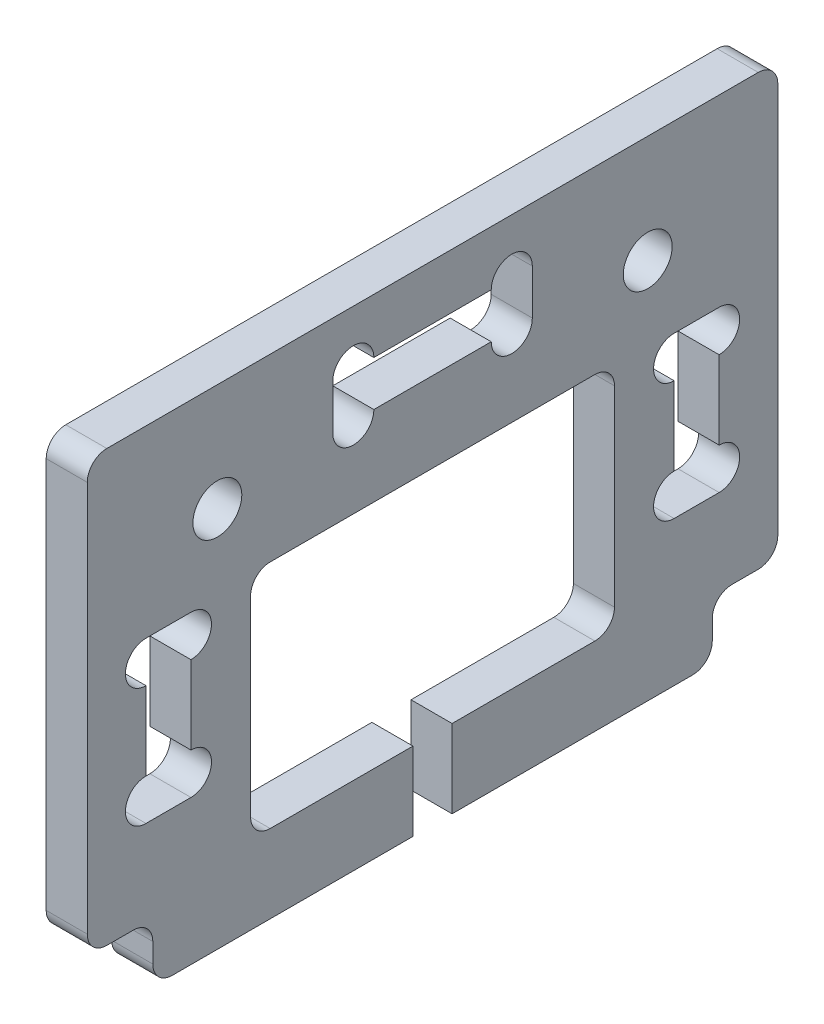
from build123d import *

# Parameters (mm, degrees)
SKETCH_1_W          = 18.6
SKETCH_1_H          = 11.8
SKETCH_1_R          = 1.25
EXTRUDE_1_DEPTH     = 2.1
FILLET_1_R          = 1
SKETCH_2_W          = 2
SKETCH_2_H          = 4
CUT_EXTRUDE_1_DEPTH = 10


with BuildPart() as part:
    # 草图1 → 凸台-拉伸1 (new body)
    with BuildSketch(Plane(origin=(0, 0, 0), x_dir=(0, 0, -1), z_dir=(1, 0, 0))):
        Polygon((14.3, -11), (17.65, -11), (17.65, 11), (-17.65, 11), (-17.65, -11), (-14.3, -11), (-14.3, -14), (14.3, -14), align=None)
        with BuildLine():
            ThreePointArc((-11.3, -5.55), (-11.60753788, -6.29246212), (-12.35, -6.6))
            Line((-12.35, -6.6), (-14.65, -6.6))
            ThreePointArc((-14.65, -6.6), (-15.7, -5.55), (-14.65, -4.5))
            Line((-14.65, -4.5), (-14.65, -0.5))
            ThreePointArc((-14.65, -0.5), (-15.7, 0.55), (-14.65, 1.6))
            Line((-14.65, 1.6), (-12.35, 1.6))
            ThreePointArc((-12.35, 1.6), (-11.60753788, 1.29246212), (-11.3, 0.55))
            ThreePointArc((-11.3, 0.55), (-11.60753788, -0.19246212), (-12.35, -0.5))
            Line((-12.35, -0.5), (-12.35, -4.5))
            ThreePointArc((-12.35, -4.5), (-11.60753788, -4.80753788), (-11.3, -5.55))
        make_face(mode=Mode.SUBTRACT)
        with Locations((0, -4.1)):
            Rectangle(SKETCH_1_W, SKETCH_1_H, mode=Mode.SUBTRACT)
        with BuildLine():
            ThreePointArc((15.7, -5.55), (15.39246212, -6.29246212), (14.65, -6.6))
            Line((14.65, -6.6), (12.35, -6.6))
            ThreePointArc((12.35, -6.6), (11.3, -5.55), (12.35, -4.5))
            Line((12.35, -4.5), (12.35, -0.5))
            ThreePointArc((12.35, -0.5), (11.3, 0.55), (12.35, 1.6))
            Line((12.35, 1.6), (14.65, 1.6))
            ThreePointArc((14.65, 1.6), (15.39246212, 1.29246212), (15.7, 0.55))
            ThreePointArc((15.7, 0.55), (15.39246212, -0.19246212), (14.65, -0.5))
            Line((14.65, -0.5), (14.65, -4.5))
            ThreePointArc((14.65, -4.5), (15.39246212, -4.80753788), (15.7, -5.55))
        make_face(mode=Mode.SUBTRACT)
        with Locations((-11, 5.5)):
            Circle(SKETCH_1_R, mode=Mode.SUBTRACT)
        with BuildLine():
            Line((3, 5.9), (-3, 5.9))
            ThreePointArc((-3, 5.9), (-4.05, 4.85), (-5.1, 5.9))
            Line((-5.1, 5.9), (-5.1, 8.2))
            ThreePointArc((-5.1, 8.2), (-4.05, 9.25), (-3, 8.2))
            Line((-3, 8.2), (3, 8.2))
            ThreePointArc((3, 8.2), (4.05, 9.25), (5.1, 8.2))
            Line((5.1, 8.2), (5.1, 5.9))
            ThreePointArc((5.1, 5.9), (4.05, 4.85), (3, 5.9))
        make_face(mode=Mode.SUBTRACT)
        with Locations((11, 5.5)):
            Circle(SKETCH_1_R, mode=Mode.SUBTRACT)
    extrude(amount=EXTRUDE_1_DEPTH)

    # 圆角1
    fillet_1_edges = [part.edges().sort_by_distance(p)[0] for p in [
        (1.05, -11, 17.65),
        (1.05, 11, 17.65),
        (1.05, 11, -17.65),
        (1.05, -11, -17.65),
        (1.05, -11, -14.3),
        (1.05, -14, -14.3),
        (1.05, -14, 14.3),
        (1.05, -11, 14.3),
        (1.05, -10, -9.3),
        (1.05, 1.8, -9.3),
        (1.05, 1.8, 9.3),
        (1.05, -10, 9.3),
    ]]
    fillet(fillet_1_edges, radius=FILLET_1_R)

    # 草图2 → 切除-拉伸1 (cut)
    with BuildSketch(Plane(origin=(2.1, 0, 0), x_dir=(0, 0, -1), z_dir=(1, 0, 0))):
        with Locations((0, -12)):
            Rectangle(SKETCH_2_W, SKETCH_2_H)
    extrude(amount=-CUT_EXTRUDE_1_DEPTH, mode=Mode.SUBTRACT)


solid = part.part
